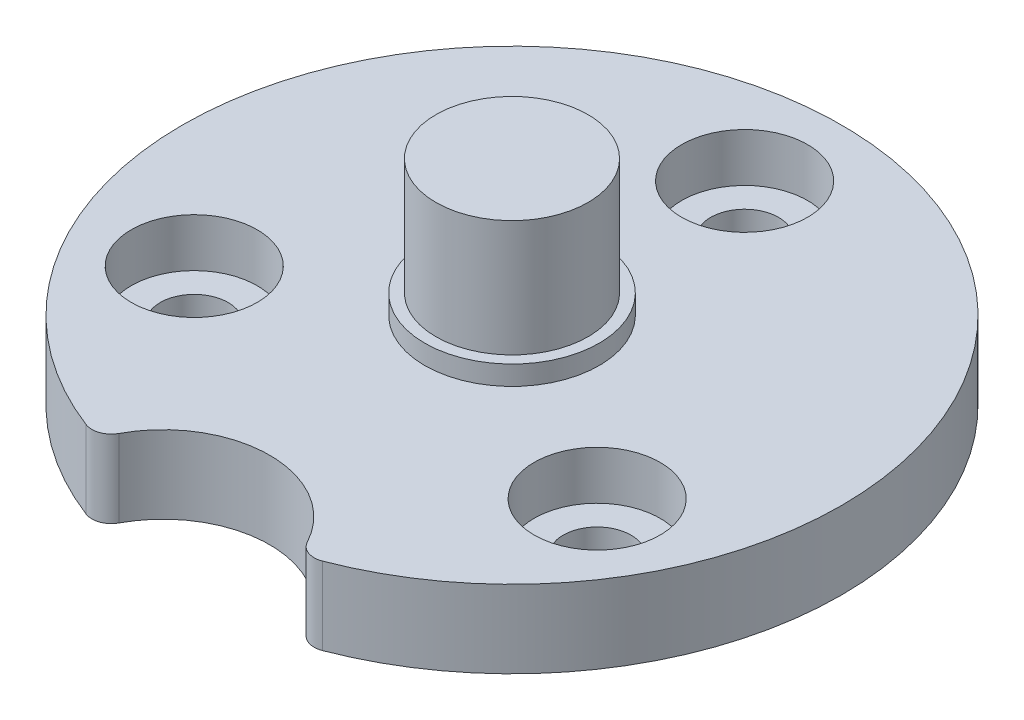
from build123d import *

# Parameters (mm, degrees)
SKETCH1_R           = 17
SKETCH1_R_2         = 1.75
BOSS_EXTRUDE1_DEPTH = 4
SKETCH2_R           = 3.25
CUT_EXTRUDE1_DEPTH  = 2.5
SKETCH3_R           = 4.5
BOSS_EXTRUDE2_DEPTH = 1
SKETCH4_R           = 3.925
BOSS_EXTRUDE3_DEPTH = 6
CUT_EXTRUDE2_REACH  = 27.04
SKETCH5_R           = 5.5
FILLET1_R           = 1


with BuildPart() as part:
    # Sketch1 → Boss-Extrude1 (new body)
    with BuildSketch(Plane(origin=(0, 0, 0), x_dir=(1, 0, 0), z_dir=(0, 1, 0))):
        with Locations(Location((0, 0, 0), (0, 0, 270))):
            Circle(SKETCH1_R)
        with Locations(Location((0, 12, 0), (0, 0, 270))):
            Circle(SKETCH1_R_2, mode=Mode.SUBTRACT)
        with Locations(Location((10.392304845, -6, 0), (0, 0, 270))):
            Circle(SKETCH1_R_2, mode=Mode.SUBTRACT)
        with Locations(Location((-10.392304845, -6, 0), (0, 0, 270))):
            Circle(SKETCH1_R_2, mode=Mode.SUBTRACT)
    extrude(amount=BOSS_EXTRUDE1_DEPTH)

    # Sketch2 → Cut-Extrude1 (cut)
    with BuildSketch(Plane(origin=(0, 4, 0), x_dir=(1, 0, 0), z_dir=(0, 1, 0))):
        with Locations(Location((0, 12, 0), (0, 0, 270))):
            Circle(SKETCH2_R)
        with Locations(Location((10.392304845, -6, 0), (0, 0, 270))):
            Circle(SKETCH2_R)
        with Locations(Location((-10.392304845, -6, 0), (0, 0, 270))):
            Circle(SKETCH2_R)
    extrude(amount=-CUT_EXTRUDE1_DEPTH, mode=Mode.SUBTRACT)

    # Sketch3 → Boss-Extrude2 (add)
    with BuildSketch(Plane(origin=(0, 4, 0), x_dir=(1, 0, 0), z_dir=(0, 1, 0))):
        with Locations(Location((0, 0, 0), (0, 0, 270))):
            Circle(SKETCH3_R)
    extrude(amount=BOSS_EXTRUDE2_DEPTH)

    # Sketch4 → Boss-Extrude3 (add)
    with BuildSketch(Plane(origin=(0, 5, 0), x_dir=(1, 0, 0), z_dir=(0, 1, 0))):
        with Locations(Location((0, 0, 0), (0, 0, 270))):
            Circle(SKETCH4_R)
    extrude(amount=BOSS_EXTRUDE3_DEPTH)

    # Sketch5 → Cut-Extrude2 (cut, up to next)
    with BuildSketch(Plane(origin=(0, 4, 0), x_dir=(1, 0, 0), z_dir=(0, 1, 0)), mode=Mode.PRIVATE) as cut_extrude2_sk1:
        with Locations((0, -18)):
            Circle(SKETCH5_R)
    cut_extrude2_tool1 = extrude(cut_extrude2_sk1.sketch, amount=-CUT_EXTRUDE2_REACH, mode=Mode.PRIVATE) & part.part
    add(cut_extrude2_tool1.solids().sort_by_distance((0, 4, 18))[0], mode=Mode.SUBTRACT)

    # Fillet1
    fillet1_edges = [part.edges().sort_by_distance(p)[0] for p in [
        (-5.192768409, 2, 16.1875),
        (5.192768409, 2, 16.1875),
    ]]
    fillet(fillet1_edges, radius=FILLET1_R)


solid = part.part
